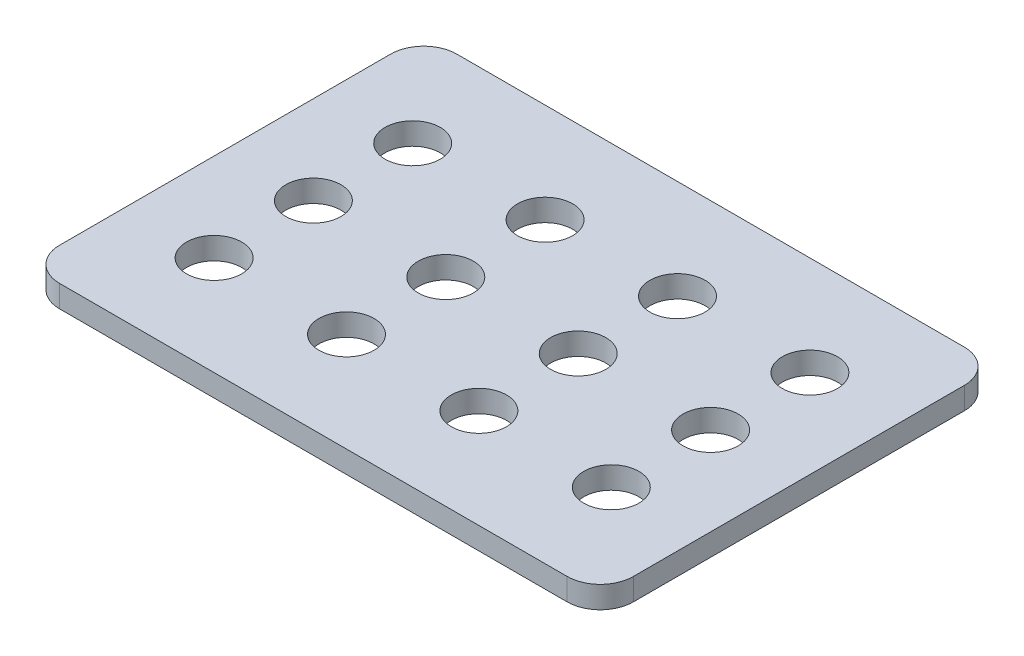
from build123d import *

# Parameters (mm, degrees)
SKETCH1_R           = 12.5
BOSS_EXTRUDE1_DEPTH = 10


with BuildPart() as part:
    # Sketch1 → Boss-Extrude1 (new body)
    with BuildSketch(Plane(origin=(0, 0, 0), x_dir=(1, 0, 0), z_dir=(0, 1, 0))):
        with BuildLine():
            Line((15, 0), (245, 0))
            ThreePointArc((245, 0), (255.606601718, 4.393398282), (260, 15))
            Line((260, 15), (260, 165))
            ThreePointArc((260, 165), (255.606601718, 175.606601718), (245, 180))
            Line((245, 180), (15, 180))
            ThreePointArc((15, 180), (4.393398282, 175.606601718), (0, 165))
            Line((0, 165), (0, 15))
            ThreePointArc((0, 15), (4.393398282, 4.393398282), (15, 0))
        make_face()
        with Locations(Location((40, 135, 0), (0, 0, 270))):
            Circle(SKETCH1_R, mode=Mode.SUBTRACT)
        with Locations(Location((100, 135, 0), (0, 0, 270))):
            Circle(SKETCH1_R, mode=Mode.SUBTRACT)
        with Locations(Location((160, 135, 0), (0, 0, 270))):
            Circle(SKETCH1_R, mode=Mode.SUBTRACT)
        with Locations(Location((220, 135, 0), (0, 0, 270))):
            Circle(SKETCH1_R, mode=Mode.SUBTRACT)
        with Locations(Location((100, 90, 0), (0, 0, 270))):
            Circle(SKETCH1_R, mode=Mode.SUBTRACT)
        with Locations(Location((160, 90, 0), (0, 0, 270))):
            Circle(SKETCH1_R, mode=Mode.SUBTRACT)
        with Locations(Location((220, 90, 0), (0, 0, 270))):
            Circle(SKETCH1_R, mode=Mode.SUBTRACT)
        with Locations(Location((100, 45, 0), (0, 0, 270))):
            Circle(SKETCH1_R, mode=Mode.SUBTRACT)
        with Locations(Location((160, 45, 0), (0, 0, 270))):
            Circle(SKETCH1_R, mode=Mode.SUBTRACT)
        with Locations(Location((220, 45, 0), (0, 0, 270))):
            Circle(SKETCH1_R, mode=Mode.SUBTRACT)
        with Locations(Location((40, 90, 0), (0, 0, 270))):
            Circle(SKETCH1_R, mode=Mode.SUBTRACT)
        with Locations(Location((40, 45, 0), (0, 0, 270))):
            Circle(SKETCH1_R, mode=Mode.SUBTRACT)
    extrude(amount=-BOSS_EXTRUDE1_DEPTH)


solid = part.part
